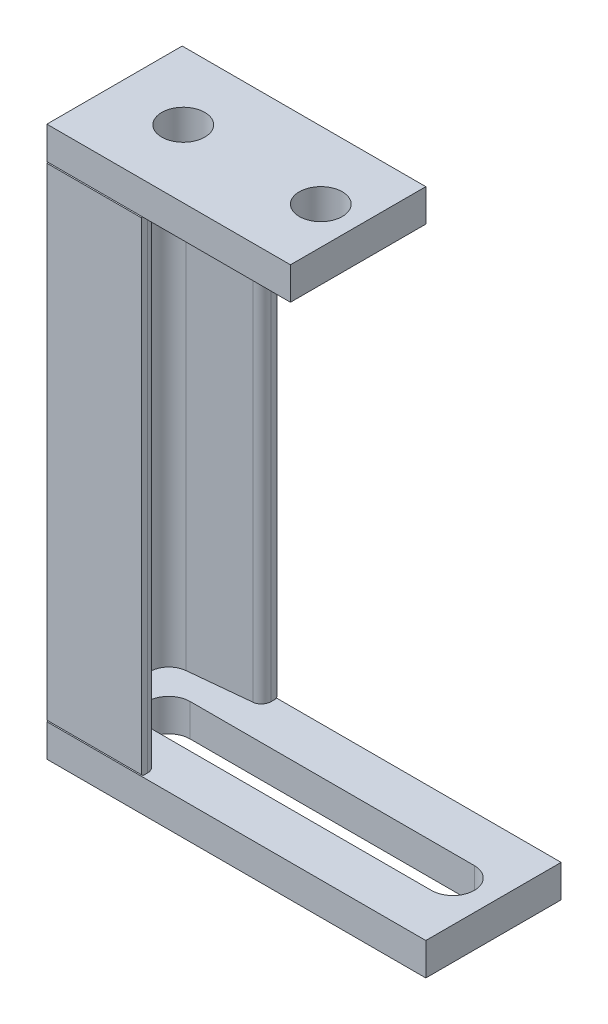
from build123d import *

# Parameters (mm, degrees)
SKETCH1_W                 = 90
SKETCH1_H                 = 50
BOSS_EXTRUDE1_DEPTH       = 11.999999994
BOSS_EXTRUDE2_DEPTH       = 35
SKETCH3_W                 = 50
SKETCH3_H                 = 12
BOSS_EXTRUDE3_DEPTH       = 105
SKETCH4_W                 = 32.855882012
SKETCH4_H                 = 179.2
CUT_EXTRUDE1_DEPTH        = 32
CUT_EXTRUDE2_REACH        = 250.023
DRAFT1_ANGLE              = 5.699999999
M13_CLEARANCE_HOLE1_D     = 15.88
M13_CLEARANCE_HOLE2_D     = 15.88
M13_CLEARANCE_HOLE2_DEPTH = 140
M13_CLEARANCE_HOLE3_D     = 15.88
FILLET1_R                 = 3.5
FILLET2_R                 = 7


with BuildPart() as part:
    # Sketch1 → Boss-Extrude1 (new body)
    with BuildSketch(Plane.XZ.offset(-179.2)):
        with Locations((45, 0)):
            Rectangle(SKETCH1_W, SKETCH1_H)
    extrude(amount=-BOSS_EXTRUDE1_DEPTH)

    # Sketch2 → Boss-Extrude2 (add)
    with BuildSketch(Plane(origin=(0, 0, 0), x_dir=(0, -1, 0), z_dir=(-1, 0, 0))):
        Polygon((-0.5, -25), (0, -24.5), (0, -25), (12, -25), (12, 25), (0, 25), (0, 24.5), (-0.500000019, 25), (-178.7, 25), (-179.2, 24.5), (-179.2, -24.5), (-178.7, -25), align=None)
    extrude(amount=-BOSS_EXTRUDE2_DEPTH)

    # Sketch3 → Boss-Extrude3 (add)
    with BuildSketch(Plane(origin=(35, 0, 0), x_dir=(0, 0, -1), z_dir=(1, 0, 0))):
        with Locations((0, -5.999999989)):
            Rectangle(SKETCH3_W, SKETCH3_H)
    extrude(amount=BOSS_EXTRUDE3_DEPTH)

    # Sketch4 → Cut-Extrude1 (cut)
    with BuildSketch(Plane(origin=(35, 0, 0), x_dir=(0, 0, -1), z_dir=(1, 0, 0))):
        with Locations((0, 89.600000011)):
            Rectangle(SKETCH4_W, SKETCH4_H)
    extrude(amount=-CUT_EXTRUDE1_DEPTH, mode=Mode.SUBTRACT)

    # Sketch5 → Cut-Extrude2 (cut, up to next)
    with BuildSketch(Plane.XZ.offset(12), mode=Mode.PRIVATE) as cut_extrude2_sk1:
        with BuildLine():
            Line((125, 7.94), (20, 7.94))
            ThreePointArc((20, 7.94), (12.06, 0), (20, -7.94))
            Line((20, -7.94), (125, -7.94))
            ThreePointArc((125, -7.94), (132.94, 0), (125, 7.94))
        make_face()
    cut_extrude2_tool1 = extrude(cut_extrude2_sk1.sketch, amount=-CUT_EXTRUDE2_REACH, mode=Mode.PRIVATE) & part.part
    add(cut_extrude2_tool1.solids().sort_by_distance((72.5, -12, 0))[0], mode=Mode.SUBTRACT)

    # Draft1
    draft1_faces = [part.faces().sort_by_distance(p)[0] for p in [
        (19, 89.600000011, -16.427941006),
        (19, 89.600000011, 16.427941006),
    ]]
    draft(draft1_faces, Plane(origin=(3, 0, 0), x_dir=(0, 0, 1), z_dir=(1, 0, 0)), DRAFT1_ANGLE)

    # M13 Clearance Hole1 (through all)
    with Locations(Plane(origin=(3, 0, 0), x_dir=(0, 0, -1), z_dir=(1, 0, 0))):
        with Locations((0, 38.8)):
            Hole(M13_CLEARANCE_HOLE1_D / 2)

    # M13 Clearance Hole2
    with Locations(Plane.ZY):
        with Locations((0, 89.6), (0, 115), (0, 140.4), (0, 165.8)):
            Hole(M13_CLEARANCE_HOLE2_D / 2, depth=M13_CLEARANCE_HOLE2_DEPTH)

    # M13 Clearance Hole3 (through all)
    with Locations(Plane(origin=(0, 179.2, 0), x_dir=(-1, 0, 0), z_dir=(0, -1, 0))):
        with Locations((-76.2, 0), (-25.4, 0)):
            Hole(M13_CLEARANCE_HOLE3_D / 2)

    # Fillet1
    fillet1_edges = [part.edges().sort_by_distance(p)[0] for p in [
        (35, 89.6, 19.621965629),
        (35, 89.6, -19.621965629),
    ]]
    fillet(fillet1_edges, radius=FILLET1_R)

    # Fillet2
    fillet2_edges = [part.edges().sort_by_distance(p)[0] for p in [
        (3, 89.6, 16.427941006),
        (3, 89.6, -16.427941006),
    ]]
    fillet(fillet2_edges, radius=FILLET2_R)


solid = part.part
